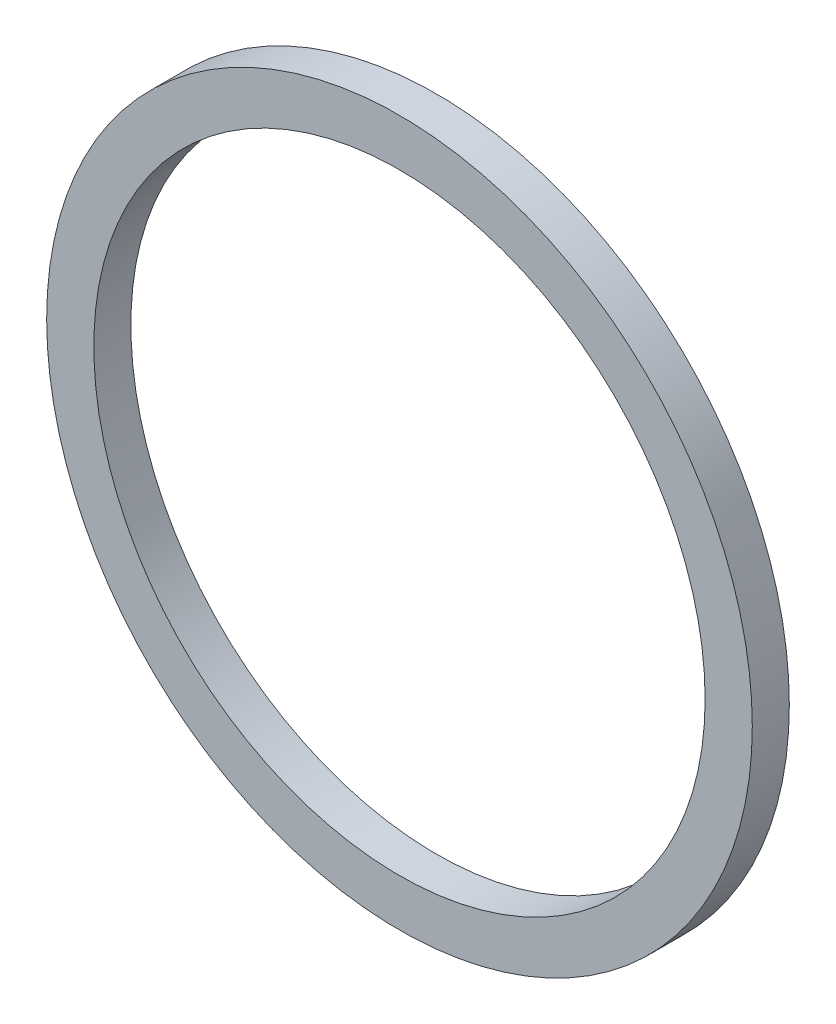
from build123d import *

# Parameters (mm, degrees)
SKETCH1_R      = 20.95
SKETCH1_R_2    = 18.15
EXTRUDE1_DEPTH = 2.2


with BuildPart() as part:
    # Sketch1 → Extrude1 (new body)
    with BuildSketch(Plane.XY):
        Circle(SKETCH1_R)
        Circle(SKETCH1_R_2, mode=Mode.SUBTRACT)
    extrude(amount=-EXTRUDE1_DEPTH)


solid = part.part
